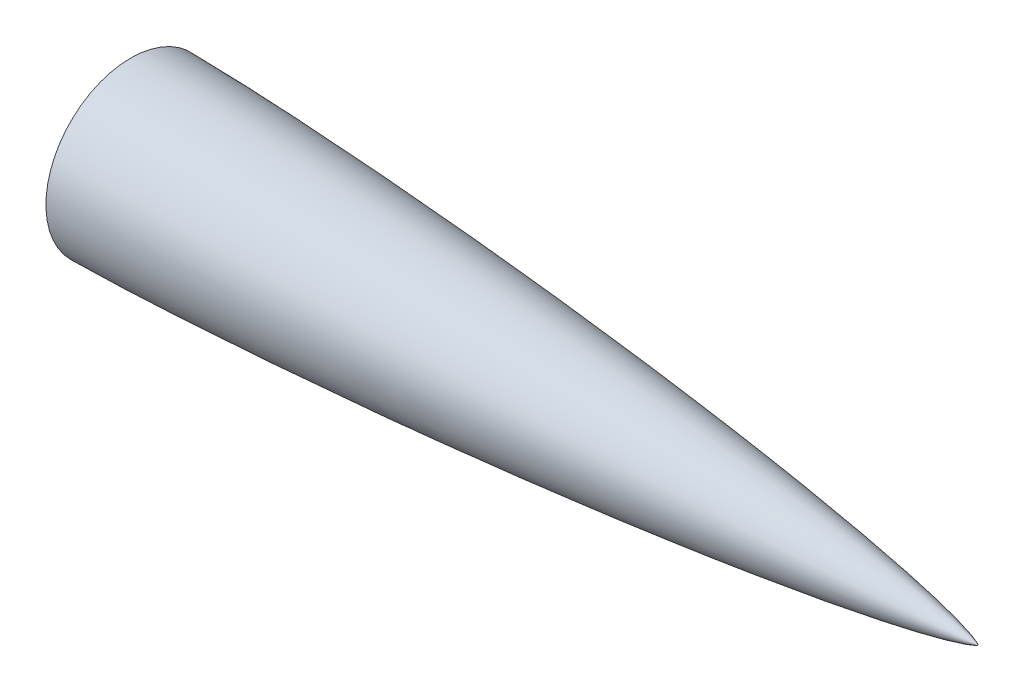
from build123d import *


with BuildPart() as part:
    # Sketch1 → Revolve2 (revolve)
    with BuildSketch(Plane.XY):
        with BuildLine():
            Line((500, 0), (-500, 0))
            Line((-500, 0), (-500, 100))
            add(Edge.make_bspline(
                [(500, 0), (499.999855374, 0.001056677), (499.999473149, 0.003147601), (499.989884113, 0.027813593), (499.95951609, 0.068428484), (499.894111128, 0.140909961), (499.678445857, 0.324546207), (499.330060206, 0.55242907), (498.699898099, 0.905298017), (497.703206304, 1.379777474), (496.461813741, 1.902240697), (494.313191943, 2.717314836), (491.398535344, 3.699239539), (487.470469287, 4.897048022), (482.519428311, 6.269517839), (475.787257881, 8.000467934), (468.497360792, 9.722586562), (461.002982952, 11.385545515), (451.696581811, 13.344002362), (442.006011587, 15.285635239), (430.679025095, 17.441789284), (413.901531966, 20.476011424), (393.275539875, 23.982925192), (368.790445546, 27.885577801), (340.438902453, 32.120980386), (304.958453194, 37.131974355), (262.329144219, 42.761039626), (212.536766383, 48.871910527), (155.57018809, 55.337106186), (98.554302724, 61.350650609), (41.496842523, 66.955198723), (-15.596759334, 72.177910176), (-72.722642384, 77.03434742), (-122.733590964, 80.968680697), (-165.617260354, 84.114268224), (-201.364603268, 86.580640704), (-229.968921229, 88.458500019), (-258.579505396, 90.238053044), (-287.196258069, 91.915210718), (-315.819087177, 93.484621756), (-344.447947956, 94.939242421), (-369.503505798, 96.103358625), (-390.983496729, 97.015458616), (-408.886078409, 97.712533998), (-423.209733631, 98.229399644), (-437.408863695, 98.697574833), (-449.755635127, 99.062358318), (-460.249462879, 99.338613808), (-468.889857125, 99.540978347), (-475.802544221, 99.686335298), (-481.851472931, 99.79670016), (-487.03650511, 99.877758364), (-491.357523334, 99.9333083), (-494.814434067, 99.971217003), (-497.407188011, 99.989281484), (-499.135724286, 100), (-500, 100)],
                knots=[0, 0, 0, 0, 0, 4.228e-06, 8.457e-06, 0.000104249, 0.00020004, 0.000391624, 0.001131299, 0.001754843, 0.003068165, 0.0047748, 0.006481435, 0.010883451, 0.015285467, 0.02108913, 0.026892792, 0.038500117, 0.04504457, 0.051589022, 0.064677927, 0.077766832, 0.090855736, 0.119329113, 0.14780249, 0.176275912, 0.204749334, 0.26169606, 0.318642868, 0.375589757, 0.432536528, 0.489483298, 0.546430089, 0.60337688, 0.660323574, 0.688797053, 0.717270532, 0.745743931, 0.774217331, 0.802690722, 0.831164113, 0.859637345, 0.888110576, 0.902347334, 0.916584091, 0.930820849, 0.945057606, 0.958793205, 0.965661004, 0.972528803, 0.979396602, 0.986264402, 0.989698301, 0.993132201, 0.9965661, 1, 1, 1, 1, 1], degree=4))
        make_face()
    revolve(axis=Axis((500, 0, 0), (-1, 0, 0)))


solid = part.part
